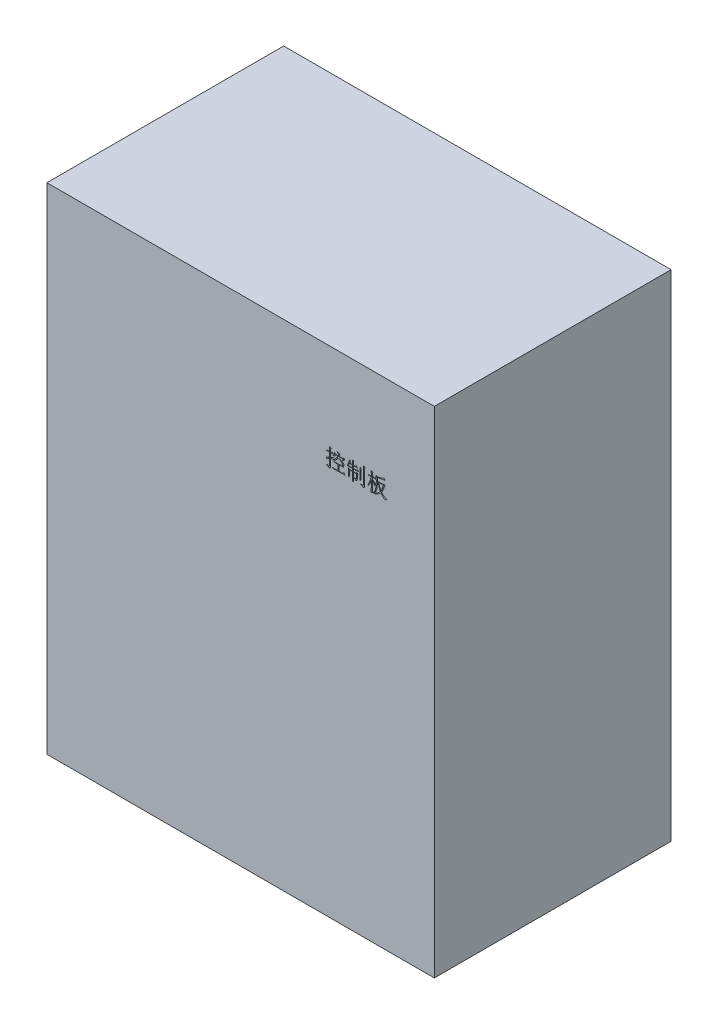
from build123d import *

# Parameters (mm, degrees)
SKETCH_1_W          = 90
SKETCH_1_H          = 115
EXTRUDE_1_DEPTH     = 55
CUT_EXTRUDE_1_DEPTH = 2


with BuildPart() as part:
    # 草图1 → 凸台-拉伸1 (new body)
    with BuildSketch(Plane.XY):
        with Locations((67.676767677, 3.775252525)):
            Rectangle(SKETCH_1_W, SKETCH_1_H)
    extrude(amount=EXTRUDE_1_DEPTH)

    # 草图2 → 切除-拉伸1 (cut)
    # profile 1 of 11: a face of its own
    with BuildSketch(Plane.XY.offset(55)):
        with BuildLine():
            Line((89.345281239, 38.548668803), (91.011146623, 38.548668803))
            Line((91.011146623, 38.548668803), (91.238310085, 38.775832264))
            Line((91.238310085, 38.775832264), (91.579055277, 38.435087072))
            Line((91.579055277, 38.435087072), (90.537889412, 38.435087072))
            Line((90.537889412, 38.435087072), (90.537889412, 37.157643162))
            Line((90.537889412, 37.157643162), (91.389752392, 37.157643162))
            Line((91.389752392, 37.157643162), (91.635846142, 37.403736912))
            Line((91.635846142, 37.403736912), (91.995521623, 37.044061431))
            Line((91.995521623, 37.044061431), (89.591374989, 37.044061431))
            add(Edge.make_bspline(
                [(89.591374989, 37.044061431), (89.551154277, 37.043404714), (89.472206994, 37.042115678), (89.355994735, 37.03147406), (89.244488774, 37.013488045), (89.17247295, 36.995914879), (89.137048066, 36.987270565)],
                knots=[0, 0, 0, 0, 1.051078301, 2.063110603, 3.047236021, 4, 4, 4, 4], degree=3))
            Line((89.137048066, 36.987270565), (88.966675469, 37.157643162))
            Line((88.966675469, 37.157643162), (90.272865373, 37.157643162))
            Line((90.272865373, 37.157643162), (90.272865373, 38.435087072))
            Line((90.272865373, 38.435087072), (89.704956719, 38.435087072))
            Line((89.704956719, 38.435087072), (89.496723546, 38.397226495))
            Line((89.496723546, 38.397226495), (89.345281239, 38.548668803))
        make_face()
    # profile 2 of 11: a face of its own
    with BuildSketch(Plane.XY.offset(55)):
        with BuildLine():
            add(Edge.make_bspline(
                [(90.216074508, 39.46573611), (90.167694131, 39.420378969), (90.072926459, 39.331533224), (89.92969725, 39.205173323), (89.789079639, 39.088093427), (89.650670022, 38.980493258), (89.514645501, 38.88214768), (89.380954864, 38.793137378), (89.249685816, 38.713199904), (89.161349521, 38.666281897), (89.118117777, 38.643320245)],
                knots=[0, 0, 0, 0, 1.156336434, 2.26503634, 3.329987673, 4.346491992, 5.321449847, 6.25617807, 7.146574306, 8, 8, 8, 8], degree=3))
            Line((89.118117777, 38.643320245), (89.0802572, 38.699409988))
            add(Edge.make_bspline(
                [(89.0802572, 38.699409988), (89.134168871, 38.742880194), (89.24053041, 38.82864192), (89.390941511, 38.96344092), (89.531800521, 39.100267309), (89.661848122, 39.239913323), (89.783297323, 39.380681982), (89.893105626, 39.524865108), (89.994376835, 39.670591919), (90.054002726, 39.771285589), (90.083562489, 39.82120486)],
                knots=[0, 0, 0, 0, 1.097558762, 2.165357468, 3.200105271, 4.20915088, 5.189137413, 6.145661431, 7.080704579, 8, 8, 8, 8], degree=3))
            Line((90.083562489, 39.82120486), (90.405377392, 39.521825854))
            Line((90.405377392, 39.521825854), (90.216074508, 39.46573611))
        make_face()
    # profile 3 of 11: a face of its own
    with BuildSketch(Plane.XY.offset(55)):
        with BuildLine():
            Line((90.651471142, 39.613672809), (90.689331719, 39.669762553))
            add(Edge.make_bspline(
                [(90.689331719, 39.669762553), (90.734690795, 39.651585201), (90.822068142, 39.616569304), (90.947497241, 39.565346733), (91.061046803, 39.51485052), (91.164207006, 39.469325017), (91.255683663, 39.425198259), (91.335389396, 39.382683761), (91.405179162, 39.345029891), (91.463626965, 39.307763612), (91.513577753, 39.272322915), (91.556842797, 39.237348813), (91.593284262, 39.201528298), (91.62413269, 39.165735155), (91.647827901, 39.128930924), (91.666974466, 39.092445312), (91.677994067, 39.054748016), (91.685069699, 39.006554185), (91.684262392, 38.950075795), (91.676281346, 38.888523534), (91.657499055, 38.835346508), (91.628402819, 38.794279473), (91.59852154, 38.763523761), (91.574772867, 38.740281396), (91.557164198, 38.724330743), (91.545512594, 38.720471552), (91.5411947, 38.719041399)],
                knots=[0, 0, 0, 0, 2.222387381, 4.281090571, 6.16104692, 7.873717546, 9.409149256, 10.778394997, 11.982114518, 13.014137748, 13.928452118, 14.766772039, 15.540917158, 16.249939126, 16.910287843, 17.528216072, 18.116646233, 18.686347911, 19.738588089, 20.67355028, 21.50081465, 22.273206655, 22.942476537, 23.446079015, 23.794725926, 24, 24, 24, 24], degree=3))
            add(Edge.make_bspline(
                [(91.5411947, 38.719041399), (91.534521576, 38.719791907), (91.520188367, 38.721403924), (91.499307523, 38.733718842), (91.476928703, 38.750891942), (91.454696077, 38.776717811), (91.430262236, 38.807813167), (91.404904981, 38.846375212), (91.378481624, 38.891904446), (91.361105841, 38.925097597), (91.351891816, 38.942699251)],
                knots=[0, 0, 0, 0, 0.527544467, 1.133113159, 1.886286847, 2.76587534, 3.823244141, 5.026973888, 6.423464563, 8, 8, 8, 8], degree=3))
            add(Edge.make_bspline(
                [(91.351891816, 38.942699251), (91.337598369, 38.966820402), (91.307376593, 39.017821677), (91.250056054, 39.093004367), (91.180756389, 39.171740784), (91.0988224, 39.253650563), (91.005300097, 39.339602022), (90.898487616, 39.427967743), (90.77995324, 39.520882931), (90.695395827, 39.581950365), (90.651471142, 39.613672809)],
                knots=[0, 0, 0, 0, 0.688371872, 1.455479582, 2.318090961, 3.264097909, 4.300380693, 5.437681015, 6.668962925, 8, 8, 8, 8], degree=3))
        make_face()
    # profile 4 of 11: a face of its own
    with BuildSketch(Plane.XY.offset(55)):
        with BuildLine():
            Line((91.314031239, 39.615075053), (91.484403835, 40.050471687))
            Line((91.484403835, 40.050471687), (89.5724447, 40.050471687))
            add(Edge.make_bspline(
                [(89.5724447, 40.050471687), (89.572163558, 40.023355769), (89.571632523, 39.972138015), (89.568032352, 39.89919341), (89.562874998, 39.834525011), (89.554818259, 39.777923456), (89.542884018, 39.7284272), (89.519392847, 39.688167509), (89.48872132, 39.654958742), (89.44996201, 39.633695728), (89.412279363, 39.617356588), (89.378174078, 39.606722481), (89.350651495, 39.597587497), (89.333644029, 39.596577757), (89.32635095, 39.596144764)],
                knots=[0, 0, 0, 0, 1.659337105, 3.134229793, 4.469274937, 5.626275952, 6.636097599, 7.558581424, 8.448790264, 9.366159641, 10.237556677, 10.961212527, 11.554551027, 12, 12, 12, 12], degree=3))
            add(Edge.make_bspline(
                [(89.32635095, 39.596144764), (89.311943328, 39.597865491), (89.278924351, 39.601809003), (89.239575633, 39.619349681), (89.208681328, 39.63692312), (89.1906037, 39.648966756), (89.178136634, 39.660025024), (89.175837484, 39.668458748), (89.174908642, 39.671865918)],
                knots=[0, 0, 0, 0, 1.48119583, 3.394562111, 4.36050321, 5.118249749, 5.643778524, 6, 6, 6, 6], degree=3))
            add(Edge.make_bspline(
                [(89.174908642, 39.671865918), (89.176689725, 39.683035661), (89.181007032, 39.71011089), (89.205949537, 39.75216896), (89.240928412, 39.804652581), (89.271442132, 39.840910971), (89.288490373, 39.861168803)],
                knots=[0, 0, 0, 0, 0.602804915, 1.46118676, 2.581546234, 4, 4, 4, 4], degree=3))
            add(Edge.make_bspline(
                [(89.288490373, 39.861168803), (89.300924933, 39.877565346), (89.32629993, 39.911025495), (89.359638078, 39.965815371), (89.389910468, 40.025184215), (89.417201065, 40.089170252), (89.441718314, 40.158026554), (89.463167597, 40.231591242), (89.482532262, 40.309613885), (89.491915724, 40.363570848), (89.496723546, 40.391216879)],
                knots=[0, 0, 0, 0, 0.857780197, 1.750457547, 2.670233957, 3.635223603, 4.649507386, 5.716600804, 6.830050396, 8, 8, 8, 8], degree=3))
            Line((89.496723546, 40.391216879), (89.5724447, 40.391216879))
            Line((89.5724447, 40.391216879), (89.5724447, 40.164053418))
            Line((89.5724447, 40.164053418), (91.484403835, 40.164053418))
            Line((91.484403835, 40.164053418), (91.635846142, 40.353356303))
            Line((91.635846142, 40.353356303), (91.938730758, 40.050471687))
            add(Edge.make_bspline(
                [(91.938730758, 40.050471687), (91.918926913, 40.0487522), (91.877312729, 40.045139009), (91.81414139, 40.02122299), (91.7483101, 39.983482359), (91.679421644, 39.930253415), (91.60659553, 39.863336846), (91.530408665, 39.781427064), (91.450424542, 39.685171545), (91.398261318, 39.614427621), (91.370822104, 39.577214476)],
                knots=[0, 0, 0, 0, 0.624762377, 1.31282471, 2.108641581, 3.014257539, 4.053041353, 5.226914023, 6.54128459, 8, 8, 8, 8], degree=3))
            Line((91.370822104, 39.577214476), (91.314031239, 39.615075053))
        make_face()
    # profile 5 of 11: a face of its own
    with BuildSketch(Plane.XY.offset(55)):
        with BuildLine():
            Line((90.026771623, 40.911449251), (90.0646322, 40.968941238))
            add(Edge.make_bspline(
                [(90.0646322, 40.968941238), (90.096423857, 40.954936183), (90.157509895, 40.928026188), (90.245170967, 40.8890802), (90.324596987, 40.851808671), (90.395812342, 40.816836938), (90.45934393, 40.784689517), (90.514535118, 40.754388785), (90.562431651, 40.727511283), (90.602453439, 40.701784128), (90.636489937, 40.677325974), (90.663795976, 40.650978862), (90.687114161, 40.624357099), (90.703908529, 40.595450371), (90.715234511, 40.565551556), (90.722005853, 40.534589374), (90.722376506, 40.502301327), (90.716492639, 40.459822048), (90.703539084, 40.41200409), (90.686845085, 40.362268963), (90.667057997, 40.323887166), (90.638075203, 40.291688419), (90.601620232, 40.266854741), (90.570416382, 40.261178298), (90.5568197, 40.25870486)],
                knots=[0, 0, 0, 0, 1.971005274, 3.78718552, 5.442142868, 6.948379248, 8.288584754, 9.481213346, 10.520635333, 11.403371319, 12.180389358, 12.893209359, 13.55193343, 14.181869875, 14.777815506, 15.360333856, 15.970420313, 16.598679906, 17.7885781, 18.774169935, 19.5752527, 20.213920393, 21.22173846, 22, 22, 22, 22], degree=3))
            add(Edge.make_bspline(
                [(90.5568197, 40.25870486), (90.54709347, 40.26074849), (90.524659722, 40.265462164), (90.495978949, 40.294939004), (90.46843761, 40.338063796), (90.452330479, 40.373382668), (90.443237969, 40.393320245)],
                knots=[0, 0, 0, 0, 0.637804645, 1.47110939, 2.572435941, 4, 4, 4, 4], degree=3))
            add(Edge.make_bspline(
                [(90.443237969, 40.393320245), (90.434315033, 40.4100229), (90.415245612, 40.445718544), (90.380788575, 40.500029587), (90.339095759, 40.558325054), (90.290297173, 40.620683381), (90.235369454, 40.688174545), (90.171490542, 40.758400043), (90.102696844, 40.83468644), (90.052693126, 40.885241789), (90.026771623, 40.911449251)],
                knots=[0, 0, 0, 0, 0.681165141, 1.455734343, 2.312029879, 3.258982338, 4.304417023, 5.441970212, 6.673939121, 8, 8, 8, 8], degree=3))
        make_face()
    # profile 6 of 11: a face of its own
    with BuildSketch(Plane.XY.offset(55)):
        with BuildLine():
            Line((89.231699508, 39.139714476), (88.606999989, 38.761108706))
            Line((88.606999989, 38.761108706), (88.606999989, 37.113472488))
            add(Edge.make_bspline(
                [(88.606999989, 37.113472488), (88.604450329, 37.088812915), (88.599424321, 37.040202808), (88.579381403, 36.969831487), (88.548569069, 36.903964761), (88.508557862, 36.84184725), (88.457609194, 36.784444326), (88.397166313, 36.73116591), (88.326203286, 36.682595), (88.274251917, 36.654682744), (88.247324508, 36.640215277)],
                knots=[0, 0, 0, 0, 0.951282364, 1.875212421, 2.79533767, 3.736905861, 4.704203426, 5.734873166, 6.825940502, 8, 8, 8, 8], degree=3))
            add(Edge.make_bspline(
                [(88.247324508, 36.640215277), (88.245419918, 36.657837642), (88.241417282, 36.69487233), (88.210627476, 36.747781175), (88.162847055, 36.798005573), (88.097407022, 36.847906053), (88.014318022, 36.897257075), (87.912395856, 36.944857468), (87.79315205, 36.993399153), (87.706480741, 37.022374532), (87.660485566, 37.037751335)],
                knots=[0, 0, 0, 0, 0.567410724, 1.192455101, 1.93008711, 2.801753461, 3.841774178, 5.047670883, 6.433242804, 8, 8, 8, 8], degree=3))
            Line((87.660485566, 37.037751335), (87.660485566, 37.113472488))
            add(Edge.make_bspline(
                [(87.660485566, 37.113472488), (87.693657822, 37.10755072), (87.757126776, 37.096220515), (87.847986656, 37.081280642), (87.930086546, 37.070165853), (88.003004825, 37.061606685), (88.067057138, 37.055813842), (88.122256324, 37.052886101), (88.168857189, 37.052507982), (88.207603575, 37.055353395), (88.240746886, 37.063657456), (88.269259509, 37.080145754), (88.291573894, 37.106191539), (88.311085178, 37.138148667), (88.324337986, 37.1784953), (88.334877124, 37.225648686), (88.340937955, 37.280657022), (88.34161575, 37.319822353), (88.34197595, 37.34063595)],
                knots=[0, 0, 0, 0, 1.808220358, 3.459693913, 4.940655569, 6.253580308, 7.399219139, 8.391232753, 9.218943302, 9.899057853, 10.471018597, 11.038839643, 11.633582565, 12.291719892, 13.037465463, 13.898517392, 14.883210947, 16, 16, 16, 16], degree=3))
            Line((88.34197595, 37.34063595), (88.34197595, 38.628596687))
            add(Edge.make_bspline(
                [(88.34197595, 38.628596687), (88.300329385, 38.604371098), (88.221439026, 38.558480988), (88.110644082, 38.492402358), (88.014975304, 38.431408958), (87.934444093, 38.376067125), (87.867823184, 38.32743604), (87.816825242, 38.283928606), (87.778295815, 38.247694851), (87.762032014, 38.222226483), (87.755137008, 38.211429219)],
                knots=[0, 0, 0, 0, 1.596009153, 3.023292197, 4.273176395, 5.353314463, 6.260656545, 7.002131711, 7.576955733, 8, 8, 8, 8], degree=3))
            Line((87.755137008, 38.211429219), (87.527973546, 38.552875533))
            add(Edge.make_bspline(
                [(87.527973546, 38.552875533), (87.548823427, 38.558309376), (87.594568447, 38.570231325), (87.668106369, 38.593834353), (87.752806001, 38.623480384), (87.848865379, 38.658555935), (87.956268317, 38.699503622), (88.075245986, 38.745381694), (88.205091338, 38.798241539), (88.295039077, 38.836037379), (88.34197595, 38.855760149)],
                knots=[0, 0, 0, 0, 0.594885919, 1.30519058, 2.131778393, 3.072962133, 4.12892683, 5.305816866, 6.59411104, 8, 8, 8, 8], degree=3))
            Line((88.34197595, 38.855760149), (88.34197595, 39.915856303))
            Line((88.34197595, 39.915856303), (87.944439892, 39.915856303))
            Line((87.944439892, 39.915856303), (87.717276431, 39.877995726))
            Line((87.717276431, 39.877995726), (87.565834123, 40.029438033))
            Line((87.565834123, 40.029438033), (88.34197595, 40.029438033))
            add(Edge.make_bspline(
                [(88.34197595, 40.029438033), (88.342115666, 40.085294697), (88.342386333, 40.193504464), (88.340496003, 40.350551576), (88.339379159, 40.497324653), (88.337349414, 40.634049249), (88.33422073, 40.760705957), (88.332028254, 40.877127035), (88.327398131, 40.983204448), (88.324448778, 41.050505426), (88.323045662, 41.082522969)],
                knots=[0, 0, 0, 0, 1.272643643, 2.465461797, 3.57841033, 4.61688262, 5.580919197, 6.465104001, 7.269793692, 8, 8, 8, 8], degree=3))
            Line((88.323045662, 41.082522969), (88.796302873, 40.872186431))
            Line((88.796302873, 40.872186431), (88.606999989, 40.718640758))
            Line((88.606999989, 40.718640758), (88.606999989, 40.029438033))
            Line((88.606999989, 40.029438033), (88.758442296, 40.029438033))
            Line((88.758442296, 40.029438033), (88.947745181, 40.218740918))
            Line((88.947745181, 40.218740918), (89.250629796, 39.915856303))
            Line((89.250629796, 39.915856303), (88.606999989, 39.915856303))
            Line((88.606999989, 39.915856303), (88.606999989, 38.950411591))
            Line((88.606999989, 38.950411591), (89.193838931, 39.215435629))
            Line((89.193838931, 39.215435629), (89.231699508, 39.139714476))
        make_face()
    # profile 7 of 11: a face of its own
    with BuildSketch(Plane.XY.offset(55)):
        with BuildLine():
            add(Edge.make_bspline(
                [(95.384043258, 37.757102296), (95.385453327, 37.792625222), (95.388449465, 37.868104914), (95.393038897, 37.987975986), (95.39523733, 38.121453423), (95.398356445, 38.268210855), (95.400388053, 38.428305527), (95.4014857, 38.601720503), (95.40344301, 38.788449156), (95.402733161, 38.9850003), (95.403439387, 39.183654612), (95.401452726, 39.377628091), (95.40037068, 39.562961949), (95.398315494, 39.73964855), (95.395168243, 39.907674291), (95.392969458, 40.067087041), (95.388292935, 40.218041648), (95.385432467, 40.31572926), (95.384043258, 40.363172008)],
                knots=[0, 0, 0, 0, 0.654692731, 1.391101799, 2.209012074, 3.112981841, 4.094341678, 5.15742433, 6.306581118, 7.533174739, 8.776983709, 9.964873981, 11.105423337, 12.19006718, 13.218828337, 14.200254234, 15.125939497, 16, 16, 16, 16], degree=3))
            Line((95.384043258, 40.363172008), (95.781579316, 40.173168001))
            Line((95.781579316, 40.173168001), (95.630137008, 40.058885149))
            Line((95.630137008, 40.058885149), (95.630137008, 38.308885149))
            add(Edge.make_bspline(
                [(95.630137008, 38.308885149), (95.630498923, 38.283875608), (95.631300797, 38.228463488), (95.635198249, 38.136850478), (95.640555771, 38.028608449), (95.646101578, 37.950835947), (95.649067296, 37.909245726)],
                knots=[0, 0, 0, 0, 0.750054126, 1.661849349, 2.749632581, 4, 4, 4, 4], degree=3))
            Line((95.649067296, 37.909245726), (95.384043258, 37.757102296))
        make_face()
    # profile 8 of 11: a face of its own
    with BuildSketch(Plane.XY.offset(55)):
        with BuildLine():
            add(Edge.make_bspline(
                [(96.254836527, 40.494281783), (96.254007566, 40.593867241), (96.252374108, 40.790099257), (96.241340446, 40.986026511), (96.235906239, 41.082522969)],
                knots=[0, 0, 0, 0, 1.014976663, 2, 2, 2, 2], degree=3))
            Line((96.235906239, 41.082522969), (96.633442296, 40.892518963))
            Line((96.633442296, 40.892518963), (96.500930277, 40.760006944))
            Line((96.500930277, 40.760006944), (96.500930277, 37.209526174))
            add(Edge.make_bspline(
                [(96.500930277, 37.209526174), (96.501433519, 37.177455518), (96.50240897, 37.115291943), (96.487875113, 37.025496132), (96.462069679, 36.942344031), (96.42234223, 36.866783595), (96.369970202, 36.798584384), (96.306242843, 36.736685887), (96.228847174, 36.683310638), (96.171107032, 36.654902546), (96.141254796, 36.640215277)],
                knots=[0, 0, 0, 0, 1.065221631, 2.064752996, 3.011361688, 3.950276852, 4.887903625, 5.861084974, 6.894159364, 8, 8, 8, 8], degree=3))
            add(Edge.make_bspline(
                [(96.141254796, 36.640215277), (96.136419509, 36.664925426), (96.126781865, 36.714177437), (96.089391768, 36.782178459), (96.035220995, 36.842419182), (95.964395032, 36.895951032), (95.876529091, 36.941976439), (95.771876153, 36.98141053), (95.650238629, 37.014842052), (95.562748599, 37.030752905), (95.516555277, 37.039153578)],
                knots=[0, 0, 0, 0, 0.758687152, 1.512207249, 2.314469735, 3.197766889, 4.185671758, 5.308103181, 6.578722005, 8, 8, 8, 8], degree=3))
            Line((95.516555277, 37.039153578), (95.516555277, 37.114874732))
            add(Edge.make_bspline(
                [(95.516555277, 37.114874732), (95.572872696, 37.111927699), (95.678471439, 37.106401823), (95.826419537, 37.100769734), (95.953132933, 37.097618728), (96.045155659, 37.094963387), (96.10834705, 37.097147332), (96.147460931, 37.106486488), (96.181380513, 37.120851085), (96.208811162, 37.14251408), (96.229663687, 37.170169218), (96.244486119, 37.203451913), (96.253705368, 37.242689665), (96.254443946, 37.270934997), (96.254836527, 37.28594845)],
                knots=[0, 0, 0, 0, 2.369395258, 4.442766888, 6.220747348, 7.693780855, 8.31364559, 8.868590947, 9.374072957, 9.849475576, 10.318856968, 10.815389983, 11.37033534, 12, 12, 12, 12], degree=3))
            Line((96.254836527, 37.28594845), (96.254836527, 40.494281783))
        make_face()
    # profile 9 of 11: a face of its own
    with BuildSketch(Plane.XY.offset(55)):
        with BuildLine():
            Line((93.661387008, 40.074309828), (93.661387008, 40.359666399))
            add(Edge.make_bspline(
                [(93.661387008, 40.359666399), (93.661525148, 40.396593074), (93.661793572, 40.468346144), (93.659910289, 40.572573437), (93.658775191, 40.670503716), (93.656785996, 40.761659384), (93.653601523, 40.846474537), (93.651441272, 40.92458544), (93.646795007, 40.996294562), (93.643857798, 41.041858305), (93.642456719, 41.063592681)],
                knots=[0, 0, 0, 0, 1.258249954, 2.444934331, 3.551990324, 4.595496403, 5.551660039, 6.444152705, 7.257844778, 8, 8, 8, 8], degree=3))
            Line((93.642456719, 41.063592681), (94.039992777, 40.892518963))
            Line((94.039992777, 40.892518963), (93.888550469, 40.759305822))
            Line((93.888550469, 40.759305822), (93.888550469, 40.074309828))
            Line((93.888550469, 40.074309828), (94.323947104, 40.074309828))
            Line((94.323947104, 40.074309828), (94.532180277, 40.30147329))
            Line((94.532180277, 40.30147329), (94.872925469, 39.960728097))
            Line((94.872925469, 39.960728097), (93.888550469, 39.960728097))
            Line((93.888550469, 39.960728097), (93.888550469, 39.401232905))
            Line((93.888550469, 39.401232905), (94.570040854, 39.401232905))
            Line((94.570040854, 39.401232905), (94.797204316, 39.628396367))
            Line((94.797204316, 39.628396367), (95.137949508, 39.287651174))
            Line((95.137949508, 39.287651174), (93.888550469, 39.287651174))
            Line((93.888550469, 39.287651174), (93.888550469, 38.773027777))
            Line((93.888550469, 38.773027777), (94.513249989, 38.773027777))
            Line((94.513249989, 38.773027777), (94.645762008, 38.962330662))
            Line((94.645762008, 38.962330662), (94.929716335, 38.754097488))
            Line((94.929716335, 38.754097488), (94.778274027, 38.621585469))
            Line((94.778274027, 38.621585469), (94.778274027, 37.694001335))
            add(Edge.make_bspline(
                [(94.778274027, 37.694001335), (94.778810036, 37.666588011), (94.779844657, 37.613673921), (94.764899755, 37.537142023), (94.73944671, 37.466466283), (94.699093964, 37.403234723), (94.646557762, 37.347203856), (94.58265617, 37.296700675), (94.505341424, 37.254178911), (94.448342064, 37.232208675), (94.418598546, 37.220744123)],
                knots=[0, 0, 0, 0, 1.017401403, 1.963821335, 2.88272422, 3.796967302, 4.73217852, 5.728861945, 6.814870297, 8, 8, 8, 8], degree=3))
            add(Edge.make_bspline(
                [(94.418598546, 37.220744123), (94.420399725, 37.237860089), (94.42395888, 37.271681484), (94.409679503, 37.322469807), (94.38121327, 37.370052695), (94.336571773, 37.413305571), (94.278728841, 37.455004995), (94.206065931, 37.493512421), (94.118944302, 37.530096046), (94.055138023, 37.550560396), (94.021062489, 37.561489315)],
                knots=[0, 0, 0, 0, 0.719770975, 1.422277761, 2.177514121, 3.034373414, 4.021596162, 5.176584016, 6.492163977, 8, 8, 8, 8], degree=3))
            Line((94.021062489, 37.561489315), (94.021062489, 37.637210469))
            add(Edge.make_bspline(
                [(94.021062489, 37.637210469), (94.064963392, 37.631278496), (94.146110837, 37.620313699), (94.257985819, 37.609809185), (94.349543364, 37.601300875), (94.413405738, 37.598248318), (94.456031463, 37.600668886), (94.481891223, 37.610081145), (94.504008334, 37.625457007), (94.521454638, 37.646995294), (94.535158068, 37.674228782), (94.544567276, 37.707252879), (94.54989994, 37.746180086), (94.550690385, 37.773911478), (94.551110566, 37.788652777)],
                knots=[0, 0, 0, 0, 2.400940231, 4.437953482, 6.090697983, 7.383408014, 7.90526813, 8.390145591, 8.85404901, 9.348756068, 9.87566582, 10.496922005, 11.201002217, 12, 12, 12, 12], degree=3))
            Line((94.551110566, 37.788652777), (94.551110566, 38.659446046))
            Line((94.551110566, 38.659446046), (93.888550469, 38.659446046))
            Line((93.888550469, 38.659446046), (93.888550469, 37.344842681))
            add(Edge.make_bspline(
                [(93.888550469, 37.344842681), (93.888846276, 37.292489576), (93.889420788, 37.190809839), (93.893077686, 37.043095328), (93.898127513, 36.904904153), (93.904439132, 36.816183627), (93.907480758, 36.773428418)],
                knots=[0, 0, 0, 0, 1.098589798, 2.133671401, 3.100599682, 4, 4, 4, 4], degree=3))
            Line((93.907480758, 36.773428418), (93.642456719, 36.640215277))
            add(Edge.make_bspline(
                [(93.642456719, 36.640215277), (93.643782066, 36.691866687), (93.646306919, 36.790265261), (93.651106239, 36.930695027), (93.653386913, 37.056922446), (93.656431938, 37.168856277), (93.658667552, 37.266545197), (93.659658565, 37.349755424), (93.661690153, 37.418686188), (93.661480092, 37.459825667), (93.661387008, 37.478055822)],
                knots=[0, 0, 0, 0, 1.479627748, 2.818766372, 4.023746565, 5.094910282, 6.025409737, 6.82195138, 7.477970797, 8, 8, 8, 8], degree=3))
            Line((93.661387008, 37.478055822), (93.661387008, 38.659446046))
            Line((93.661387008, 38.659446046), (92.998826912, 38.659446046))
            Line((92.998826912, 38.659446046), (92.998826912, 37.315395565))
            Line((92.998826912, 37.315395565), (92.752733162, 37.182883546))
            add(Edge.make_bspline(
                [(92.752733162, 37.182883546), (92.755736148, 37.263740112), (92.761654403, 37.423091406), (92.766977262, 37.658460899), (92.7705387, 37.886797963), (92.772204965, 38.107896733), (92.770621405, 38.322220162), (92.767117548, 38.529292628), (92.761921226, 38.72938728), (92.755759746, 38.860209035), (92.752733162, 38.924470085)],
                knots=[0, 0, 0, 0, 1.114655832, 2.196752345, 3.243250355, 4.260668401, 5.242671441, 6.195812807, 7.113763906, 8, 8, 8, 8], degree=3))
            Line((92.752733162, 38.924470085), (93.0177572, 38.773027777))
            Line((93.0177572, 38.773027777), (93.661387008, 38.773027777))
            Line((93.661387008, 38.773027777), (93.661387008, 39.287651174))
            Line((93.661387008, 39.287651174), (93.036687489, 39.287651174))
            add(Edge.make_bspline(
                [(93.036687489, 39.287651174), (92.996466777, 39.286994458), (92.917519494, 39.285705422), (92.801307235, 39.275063804), (92.689801274, 39.257077789), (92.61778545, 39.239504623), (92.582360566, 39.230860309)],
                knots=[0, 0, 0, 0, 1.051078301, 2.063110603, 3.047236021, 4, 4, 4, 4], degree=3))
            Line((92.582360566, 39.230860309), (92.411987969, 39.401232905))
            Line((92.411987969, 39.401232905), (93.661387008, 39.401232905))
            Line((93.661387008, 39.401232905), (93.661387008, 39.960728097))
            Line((93.661387008, 39.960728097), (92.979896623, 39.960728097))
            add(Edge.make_bspline(
                [(92.979896623, 39.960728097), (92.948822813, 39.909242419), (92.888703893, 39.809632381), (92.793741207, 39.670101894), (92.699732519, 39.543777447), (92.633305586, 39.46746103), (92.601290854, 39.43068002)],
                knots=[0, 0, 0, 0, 1.105905581, 2.139610442, 3.10337765, 4, 4, 4, 4], degree=3))
            Line((92.601290854, 39.43068002), (92.544499989, 39.449610309))
            add(Edge.make_bspline(
                [(92.544499989, 39.449610309), (92.574651151, 39.513668566), (92.632681121, 39.636957303), (92.7089659, 39.818463731), (92.774505738, 39.98756946), (92.828098803, 40.145291363), (92.870959936, 40.290850073), (92.904076973, 40.424658519), (92.929063776, 40.546418146), (92.937878518, 40.624378347), (92.942036046, 40.66114877)],
                knots=[0, 0, 0, 0, 1.326489263, 2.553007103, 3.688326024, 4.724181207, 5.673409887, 6.530529915, 7.306915108, 8, 8, 8, 8], degree=3))
            Line((92.942036046, 40.66114877), (93.301711527, 40.471845886))
            add(Edge.make_bspline(
                [(93.301711527, 40.471845886), (93.290237613, 40.465930122), (93.265878502, 40.453370958), (93.232086332, 40.424441153), (93.197223758, 40.38816226), (93.162150284, 40.342547576), (93.126560296, 40.288295139), (93.090092708, 40.225179745), (93.054101191, 40.15263582), (93.030254353, 40.101242806), (93.0177572, 40.074309828)],
                knots=[0, 0, 0, 0, 0.621409584, 1.319252158, 2.133225883, 3.049619521, 4.091735985, 5.264563186, 6.566469424, 8, 8, 8, 8], degree=3))
            Line((93.0177572, 40.074309828), (93.661387008, 40.074309828))
        make_face()
    # profile 10 of 11: a face of its own
    with BuildSketch(Plane.XY.offset(55)):
        with BuildLine():
            add(Edge.make_bspline(
                [(101.100990373, 39.418059828), (101.074288212, 39.334025574), (101.022538359, 39.171163838), (100.940675544, 38.93673104), (100.857034229, 38.719913629), (100.773481674, 38.519497346), (100.687311778, 38.336707329), (100.600424205, 38.170661699), (100.512965322, 38.021474976), (100.449737969, 37.930851101), (100.419499989, 37.88751095)],
                knots=[0, 0, 0, 0, 1.257941982, 2.437941705, 3.541995365, 4.573063656, 5.535105204, 6.424001252, 7.246291075, 8, 8, 8, 8], degree=3))
            add(Edge.make_bspline(
                [(100.419499989, 37.88751095), (100.463803611, 37.832828765), (100.550887254, 37.725344918), (100.692852608, 37.578900563), (100.840689398, 37.448162938), (100.99459943, 37.333973595), (101.153438037, 37.233562218), (101.319837146, 37.152146737), (101.491149238, 37.084000153), (101.609630825, 37.052705019), (101.668899027, 37.037050213)],
                knots=[0, 0, 0, 0, 1.095466608, 2.153260081, 3.171760661, 4.165280718, 5.134693411, 6.093307648, 7.046212746, 8, 8, 8, 8], degree=3))
            Line((101.668899027, 37.037050213), (101.668899027, 36.961329059))
            add(Edge.make_bspline(
                [(101.668899027, 36.961329059), (101.64197364, 36.959220653), (101.590637021, 36.955200714), (101.518096242, 36.942260276), (101.454532748, 36.92267549), (101.399458052, 36.897783566), (101.353789962, 36.865671025), (101.316550945, 36.828209994), (101.288052258, 36.784275296), (101.276991711, 36.751530588), (101.271362969, 36.734866719)],
                knots=[0, 0, 0, 0, 1.321355975, 2.519330509, 3.597404447, 4.569621419, 5.464482174, 6.31373748, 7.14185654, 8, 8, 8, 8], degree=3))
            add(Edge.make_bspline(
                [(101.271362969, 36.734866719), (101.226956271, 36.758377248), (101.13651747, 36.806258853), (101.007023635, 36.894698186), (100.878501925, 36.994948003), (100.751976415, 37.109040429), (100.628053997, 37.237264463), (100.505197515, 37.378611861), (100.383781123, 37.533408336), (100.307229235, 37.643815931), (100.268057681, 37.700311431)],
                knots=[0, 0, 0, 0, 0.856344774, 1.744034038, 2.66971892, 3.634941658, 4.646841014, 5.709085365, 6.827740381, 8, 8, 8, 8], degree=3))
            add(Edge.make_bspline(
                [(100.268057681, 37.700311431), (100.215275872, 37.646255959), (100.110052001, 37.538492961), (99.939474468, 37.391005226), (99.761107083, 37.25431946), (99.573444605, 37.129962467), (99.376618, 37.0179536), (99.171644775, 36.916484978), (98.957179455, 36.827784722), (98.809342276, 36.778619071), (98.734704316, 36.753797008)],
                knots=[0, 0, 0, 0, 0.994790829, 1.983178384, 2.967082931, 3.953229128, 4.94599354, 5.948258306, 6.964145451, 8, 8, 8, 8], degree=3))
            Line((98.734704316, 36.753797008), (98.696843739, 36.810587873))
            add(Edge.make_bspline(
                [(98.696843739, 36.810587873), (98.771077893, 36.845818433), (98.917142798, 36.91513893), (99.126825313, 37.030850045), (99.324705836, 37.154041214), (99.510642767, 37.285344863), (99.685203261, 37.423484577), (99.847589948, 37.56993548), (99.998908681, 37.723435606), (100.090238224, 37.833105229), (100.135545662, 37.88751095)],
                knots=[0, 0, 0, 0, 1.087294989, 2.139387739, 3.167566167, 4.170755333, 5.150394089, 6.111856039, 7.063315513, 8, 8, 8, 8], degree=3))
            add(Edge.make_bspline(
                [(100.135545662, 37.88751095), (100.106160564, 37.946574337), (100.046819609, 38.065848321), (99.968928834, 38.251682738), (99.898711897, 38.444609835), (99.835747201, 38.644140272), (99.780168338, 38.850899871), (99.732798818, 39.06476193), (99.692439716, 39.28574549), (99.672422475, 39.435961214), (99.66228845, 39.512010149)],
                knots=[0, 0, 0, 0, 0.930735249, 1.879548537, 2.841493965, 3.827168227, 4.831166319, 5.861744168, 6.917476321, 8, 8, 8, 8], degree=3))
            Line((99.66228845, 39.512010149), (99.454055277, 39.512010149))
            add(Edge.make_bspline(
                [(99.454055277, 39.512010149), (99.453336659, 39.432073009), (99.451877818, 39.269795517), (99.441176332, 39.022638596), (99.422225586, 38.768612497), (99.399268687, 38.510146053), (99.364689301, 38.253937517), (99.311094112, 38.006428338), (99.240862762, 37.77096658), (99.169535558, 37.582013839), (99.099239552, 37.436577698), (99.035932887, 37.328373629), (98.961363775, 37.221425143), (98.876359842, 37.114856292), (98.781321002, 37.008585237), (98.674876902, 36.903184925), (98.557616547, 36.798921349), (98.474395586, 36.731499297), (98.4318197, 36.697006142)],
                knots=[0, 0, 0, 0, 1.227325534, 2.491549106, 3.797434423, 5.138172562, 6.475333417, 7.76400838, 9.021937379, 10.245396153, 10.860041659, 11.500085974, 12.167979968, 12.860073136, 13.591943094, 14.355675379, 15.158762703, 16, 16, 16, 16], degree=3))
            Line((98.4318197, 36.697006142), (98.375028835, 36.753797008))
            add(Edge.make_bspline(
                [(98.375028835, 36.753797008), (98.419135235, 36.799258549), (98.506012834, 36.88880541), (98.623302151, 37.030918844), (98.729008898, 37.174514816), (98.821606756, 37.320922867), (98.900162571, 37.470367238), (98.965667559, 37.622536628), (99.018774855, 37.777178158), (99.070741469, 37.98746768), (99.117149661, 38.254619878), (99.159097142, 38.578623746), (99.183723245, 38.907481492), (99.192484898, 39.354238056), (99.185009722, 39.922235302), (99.175106296, 40.379073681), (99.17010095, 40.609966879)],
                knots=[0, 0, 0, 0, 0.653883181, 1.287971847, 1.901029547, 2.494290377, 3.075088731, 3.642658876, 4.203622543, 4.761462489, 5.877700866, 7.001767737, 8.134414056, 9.281166039, 11.615028173, 14, 14, 14, 14], degree=3))
            Line((99.17010095, 40.609966879), (99.454055277, 40.458524572))
            add(Edge.make_bspline(
                [(99.454055277, 40.458524572), (99.523270718, 40.476611636), (99.655293383, 40.511111199), (99.843065949, 40.562547003), (100.011517273, 40.609138655), (100.159837953, 40.652689085), (100.288587409, 40.691583481), (100.397129227, 40.727553168), (100.486410548, 40.758206355), (100.577553977, 40.795875961), (100.675558837, 40.840723685), (100.784963795, 40.894975941), (100.889014186, 40.949074331), (100.955075427, 40.987832096), (100.987408642, 41.006801815)],
                knots=[0, 0, 0, 0, 1.575185515, 3.00453465, 4.286774431, 5.423402618, 6.40820872, 7.247890787, 7.941233698, 8.485922522, 9.418595944, 10.31382105, 11.174711414, 12, 12, 12, 12], degree=3))
            Line((100.987408642, 41.006801815), (101.271362969, 40.647126335))
            add(Edge.make_bspline(
                [(101.271362969, 40.647126335), (101.230666836, 40.646002185), (101.143695788, 40.643599783), (101.005151577, 40.628528331), (100.850134577, 40.604482366), (100.741703875, 40.582825639), (100.684524027, 40.571405181)],
                knots=[0, 0, 0, 0, 0.824119463, 1.761212367, 2.819397703, 4, 4, 4, 4], degree=3))
            add(Edge.make_bspline(
                [(100.684524027, 40.571405181), (100.650406669, 40.564841639), (100.577534004, 40.550822301), (100.460770515, 40.52880819), (100.3290802, 40.506053472), (100.182553916, 40.480768917), (100.021353062, 40.453308834), (99.845359307, 40.424616403), (99.654587192, 40.394651738), (99.522531647, 40.373921507), (99.454055277, 40.363172008)],
                knots=[0, 0, 0, 0, 0.66811574, 1.427055813, 2.284889375, 3.238016455, 4.286444973, 5.429447753, 6.667060248, 8, 8, 8, 8], degree=3))
            Line((99.454055277, 40.363172008), (99.454055277, 39.625591879))
            Line((99.454055277, 39.625591879), (100.817036046, 39.625591879))
            Line((100.817036046, 39.625591879), (101.006338931, 39.814894764))
            Line((101.006338931, 39.814894764), (101.290293258, 39.530940437))
            Line((101.290293258, 39.530940437), (101.100990373, 39.418059828))
        make_face()
        with BuildLine():
            add(Edge.make_bspline(
                [(99.756939892, 39.512010149), (99.771643971, 39.445054447), (99.800660953, 39.312924283), (99.85211424, 39.119030348), (99.909413439, 38.931603697), (99.973450523, 38.751043685), (100.041900757, 38.576476423), (100.11709794, 38.408783548), (100.198130194, 38.247254976), (100.257530902, 38.143627718), (100.286987969, 38.092238514)],
                knots=[0, 0, 0, 0, 1.080669623, 2.132589899, 3.161729263, 4.169756105, 5.152295409, 6.117140908, 7.066282052, 8, 8, 8, 8], degree=3))
            add(Edge.make_bspline(
                [(100.286987969, 38.092238514), (100.315001733, 38.140842055), (100.371933781, 38.239618466), (100.450509888, 38.394809681), (100.523048335, 38.559441367), (100.592012036, 38.732593187), (100.655260272, 38.915069675), (100.715345, 39.105842819), (100.768953899, 39.305807453), (100.800829098, 39.442505838), (100.817036046, 39.512010149)],
                knots=[0, 0, 0, 0, 0.8845881, 1.797738118, 2.741516916, 3.720901658, 4.73616224, 5.786461557, 6.874526115, 8, 8, 8, 8], degree=3))
            Line((100.817036046, 39.512010149), (99.756939892, 39.512010149))
        make_face(mode=Mode.SUBTRACT)
    # profile 11 of 11: a face of its own
    with BuildSketch(Plane.XY.offset(55)):
        with BuildLine():
            add(Edge.make_bspline(
                [(98.299307681, 39.223147969), (98.299327154, 39.139714505), (98.299365119, 38.977054307), (98.299096402, 38.739606949), (98.30003423, 38.515014952), (98.30068107, 38.303509822), (98.301371878, 38.104858503), (98.302150496, 37.919295455), (98.302568323, 37.746816112), (98.304205391, 37.587196871), (98.305547676, 37.44042835), (98.306926093, 37.30651349), (98.308417909, 37.185688383), (98.309506507, 37.077939372), (98.311817168, 36.983060875), (98.313849605, 36.901261495), (98.3158937, 36.832314338), (98.317511, 36.790721842), (98.318237969, 36.772026174)],
                knots=[0, 0, 0, 0, 1.633756874, 3.185139452, 4.649578535, 6.031643748, 7.326758823, 8.539500151, 9.665291501, 10.704163222, 11.665240261, 12.539370989, 13.326556364, 14.031373662, 14.649333409, 15.184942319, 15.633634688, 16, 16, 16, 16], degree=3))
            Line((98.318237969, 36.772026174), (98.015353354, 36.640215277))
            add(Edge.make_bspline(
                [(98.015353354, 36.640215277), (98.016754233, 36.714534078), (98.019688105, 36.870180501), (98.02431511, 37.114159611), (98.026516563, 37.379198661), (98.029655845, 37.665484403), (98.031684832, 37.973045736), (98.032797219, 38.301874064), (98.034691577, 38.651731946), (98.03442224, 38.891984495), (98.034283642, 39.015615918)],
                knots=[0, 0, 0, 0, 0.75098197, 1.57278717, 2.465354969, 3.428753842, 4.465326528, 5.572719828, 6.750947272, 8, 8, 8, 8], degree=3))
            add(Edge.make_bspline(
                [(98.034283642, 39.015615918), (98.011648921, 38.953722464), (97.966814009, 38.83112376), (97.891392029, 38.652321111), (97.810934961, 38.479481222), (97.724126215, 38.313242881), (97.630597, 38.153918251), (97.531570697, 38.000999796), (97.42767538, 37.853809893), (97.352386891, 37.761137348), (97.314932681, 37.715034988)],
                knots=[0, 0, 0, 0, 1.058471934, 2.096623779, 3.116056311, 4.120194816, 5.107868541, 6.082521562, 7.046100646, 8, 8, 8, 8], degree=3))
            Line((97.314932681, 37.715034988), (97.258141816, 37.752194444))
            add(Edge.make_bspline(
                [(97.258141816, 37.752194444), (97.300006174, 37.828705469), (97.384176414, 37.982534447), (97.497915118, 38.221841742), (97.604095748, 38.468639296), (97.700816272, 38.724137078), (97.78814659, 38.987926911), (97.867535095, 39.259571949), (97.938061745, 39.539465768), (97.976833026, 39.729894449), (97.996423066, 39.826112713)],
                knots=[0, 0, 0, 0, 0.946605112, 1.903193631, 2.874922639, 3.862534623, 4.867784247, 5.890606494, 6.93418271, 8, 8, 8, 8], degree=3))
            Line((97.996423066, 39.826112713), (97.561026431, 39.826112713))
            Line((97.561026431, 39.826112713), (97.409584123, 39.788252136))
            Line((97.409584123, 39.788252136), (97.258141816, 39.939694444))
            Line((97.258141816, 39.939694444), (98.034283642, 39.939694444))
            add(Edge.make_bspline(
                [(98.034283642, 39.939694444), (98.03441844, 39.995551073), (98.034682963, 40.105162976), (98.03278653, 40.265949398), (98.031671909, 40.419733477), (98.029629052, 40.566039034), (98.026476378, 40.705316682), (98.02428219, 40.837390843), (98.019603801, 40.962399702), (98.016742639, 41.043259944), (98.015353354, 41.082522969)],
                knots=[0, 0, 0, 0, 1.172768499, 2.301416835, 3.376090522, 4.401755233, 5.373535746, 6.301162866, 7.175101584, 8, 8, 8, 8], degree=3))
            Line((98.015353354, 41.082522969), (98.450749989, 40.853957264))
            Line((98.450749989, 40.853957264), (98.299307681, 40.720744123))
            Line((98.299307681, 40.720744123), (98.299307681, 39.939694444))
            Line((98.299307681, 39.939694444), (98.526471142, 39.939694444))
            Line((98.526471142, 39.939694444), (98.734704316, 40.147927617))
            Line((98.734704316, 40.147927617), (99.056519219, 39.826112713))
            Line((99.056519219, 39.826112713), (98.299307681, 39.826112713))
            Line((98.299307681, 39.826112713), (98.299307681, 39.336028578))
            add(Edge.make_bspline(
                [(98.299307681, 39.336028578), (98.333931133, 39.316225638), (98.399658525, 39.278632746), (98.492826193, 39.224080451), (98.574740954, 39.172537112), (98.646874886, 39.126440598), (98.707565718, 39.083129066), (98.758108367, 39.044889254), (98.798530572, 39.011073713), (98.836490933, 38.971315949), (98.870810004, 38.92368793), (98.901113932, 38.866747419), (98.920928946, 38.809383586), (98.922996335, 38.770369313), (98.9240072, 38.751293001)],
                knots=[0, 0, 0, 0, 1.609576836, 3.055538459, 4.356101317, 5.514901716, 6.509259616, 7.363724174, 8.072604869, 8.632925068, 9.577984311, 10.430103654, 11.232387803, 12, 12, 12, 12], degree=3))
            add(Edge.make_bspline(
                [(98.9240072, 38.751293001), (98.923501716, 38.735121971), (98.92246114, 38.701832716), (98.912360693, 38.650989072), (98.897982959, 38.59754006), (98.87733333, 38.545412286), (98.856975527, 38.498349923), (98.838832532, 38.46353941), (98.825959924, 38.439216932), (98.814367386, 38.432995777), (98.810425469, 38.430880341)],
                knots=[0, 0, 0, 0, 1.117199074, 2.299836361, 3.57434675, 4.940289391, 6.177771153, 7.103089487, 7.695015376, 8, 8, 8, 8], degree=3))
            add(Edge.make_bspline(
                [(98.810425469, 38.430880341), (98.805613153, 38.431443946), (98.795172714, 38.432666702), (98.780985615, 38.443470096), (98.766239588, 38.457971072), (98.752285771, 38.479203034), (98.738521955, 38.505843336), (98.72464729, 38.538567549), (98.709774004, 38.576720691), (98.701316822, 38.604689264), (98.696843739, 38.619482104)],
                knots=[0, 0, 0, 0, 0.498607197, 1.081740723, 1.807756687, 2.668944288, 3.718709885, 4.944926498, 6.384143089, 8, 8, 8, 8], degree=3))
            add(Edge.make_bspline(
                [(98.696843739, 38.619482104), (98.686865381, 38.643458758), (98.666522735, 38.692339405), (98.629487963, 38.764673034), (98.587337423, 38.838200429), (98.54017045, 38.913167986), (98.488587877, 38.989999413), (98.429815003, 39.06667342), (98.367107437, 39.145342189), (98.322175947, 39.196904759), (98.299307681, 39.223147969)],
                knots=[0, 0, 0, 0, 0.857971833, 1.749127178, 2.683162688, 3.65822498, 4.675768006, 5.740073974, 6.849791322, 8, 8, 8, 8], degree=3))
        make_face()
    extrude(amount=-CUT_EXTRUDE_1_DEPTH, mode=Mode.SUBTRACT)


solid = part.part
